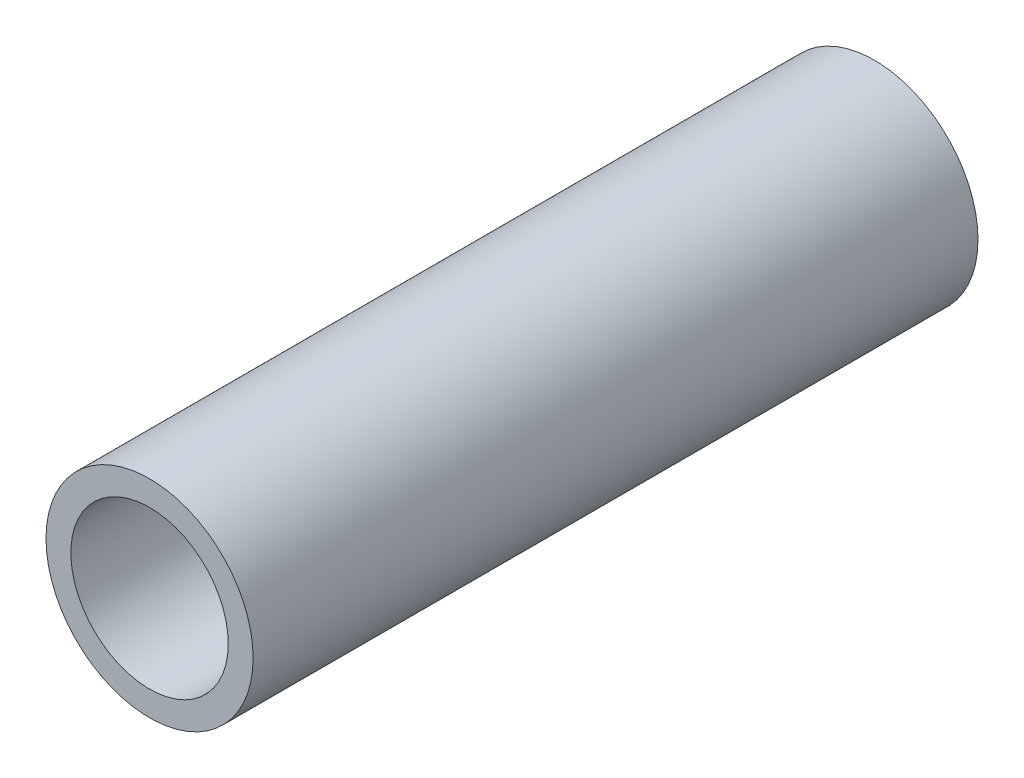
from build123d import *

# Parameters (mm, degrees)
SKETCH1_R           = 6.35
SKETCH1_R_2         = 4.826
BOSS_EXTRUDE1_DEPTH = 22.225


with BuildPart() as part:
    # Sketch1 → Boss-Extrude1 (new, symmetric)
    with BuildSketch(Plane.XY):
        Circle(SKETCH1_R)
        Circle(SKETCH1_R_2, mode=Mode.SUBTRACT)
    extrude(amount=BOSS_EXTRUDE1_DEPTH, both=True)


solid = part.part
